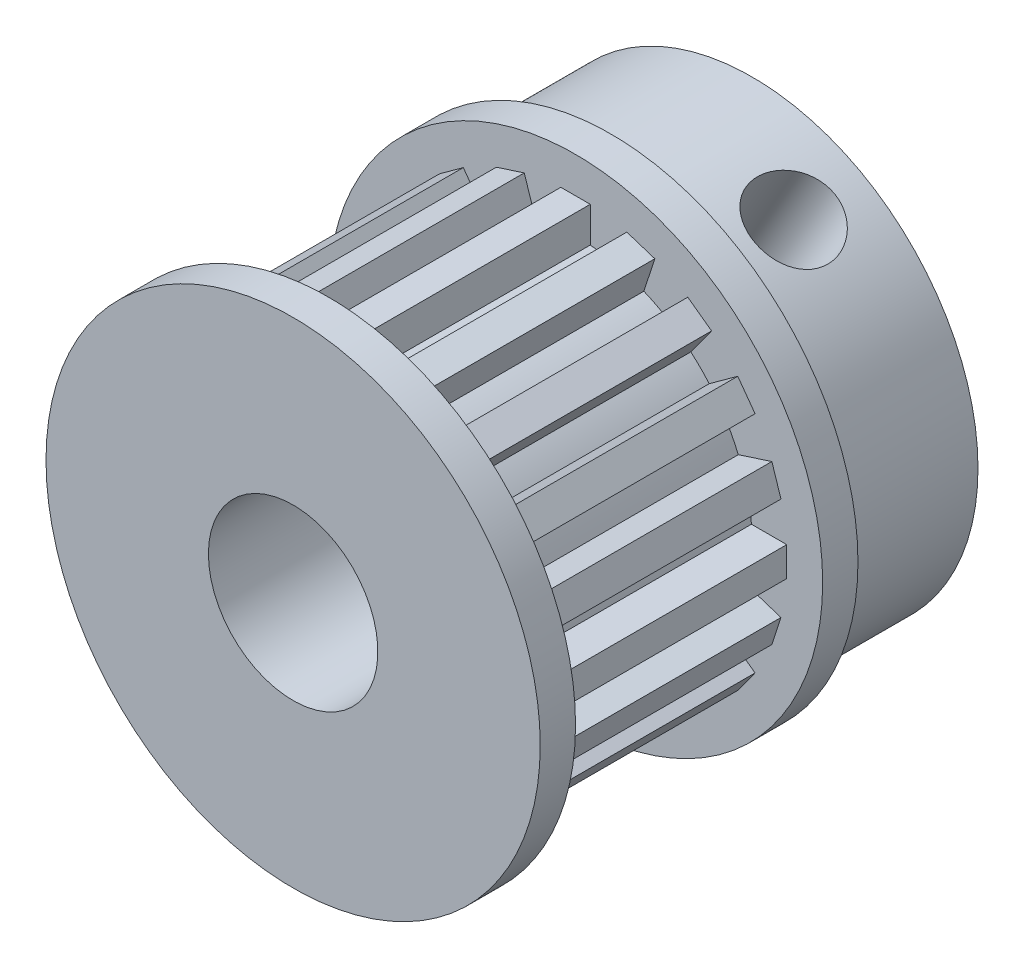
from build123d import *

# Parameters (mm, degrees)
ESQUISSE1_R                  = 2.4
BOSS_EXTRU_1_DEPTH           = 7
ESQUISSE2_R                  = 7
BOSS_EXTRU_2_DEPTH           = 1
ESQUISSE3_R                  = 2.4
ENL_V_MAT_EXTRU_1_DEPTH      = 1
BOSS_EXTRU_3_START           = 1
ESQUISSE4_R                  = 7
BOSS_EXTRU_3_DEPTH           = 1
ENL_V_START                  = -1
ESQUISSE5_R                  = 2.4
ENL_V_MAT_EXTRU_2_DEPTH      = 1
BOSS_EXTRU_4_START           = 4
ESQUISSE6_R                  = 6.4
ESQUISSE6_R_2                = 2.4
BOSS_EXTRU_4_DEPTH           = 4
ESQUISSE7_R                  = 1.15
ENL_V_MAT_EXTRU_3_DEPTH      = 8
R_P_TITION_CIRCULAIRE1_COUNT = 3


with BuildPart() as part:
    # Esquisse1 → Boss.-Extru.1 (new body)
    with BuildSketch(Plane.XY):
        with BuildLine():
            Line((0.41669139, 5.982606575), (-0.416666667, 5.982606575))
            Line((-0.416666667, 5.982606575), (-0.416666667, 4.982608643))
            ThreePointArc((-0.416666667, 4.982608643), (-0.782160073, 4.938443644), (-1.143413046, 4.867505173))
            Line((-1.143413046, 4.867505173), (-1.452430041, 5.818561689))
            Line((-1.452430041, 5.818561689), (-2.245000651, 5.561039887))
            Line((-2.245000651, 5.561039887), (-1.935984295, 4.609985337))
            ThreePointArc((-1.935984295, 4.609985337), (-2.269941446, 4.455038253), (-2.591592247, 4.27593845))
            Line((-2.591592247, 4.27593845), (-3.179377499, 5.084955444))
            Line((-3.179377499, 5.084955444), (-3.85357833, 4.595119868))
            Line((-3.85357833, 4.595119868), (-3.265794293, 3.786104547))
            ThreePointArc((-3.265794293, 3.786104547), (-3.535525134, 3.535542677), (-3.786088342, 3.265813079))
            Line((-3.786088342, 3.265813079), (-4.595105336, 3.853598331))
            Line((-4.595105336, 3.853598331), (-5.084940912, 3.179397501))
            Line((-5.084940912, 3.179397501), (-4.27592559, 2.591613464))
            ThreePointArc((-4.27592559, 2.591613464), (-4.455026989, 2.269963551), (-4.609975731, 1.93600717))
            Line((-4.609975731, 1.93600717), (-5.561032247, 2.245024164))
            Line((-5.561032247, 2.245024164), (-5.818554049, 1.452453554))
            Line((-5.818554049, 1.452453554), (-4.867499499, 1.143437199))
            ThreePointArc((-4.867499499, 1.143437199), (-4.938439762, 0.782184577), (-4.982606575, 0.41669139))
            Line((-4.982606575, 0.41669139), (-5.982606575, 0.41669139))
            Line((-5.982606575, 0.41669139), (-5.982606575, -0.416666667))
            Line((-5.982606575, -0.416666667), (-4.982608643, -0.416666667))
            ThreePointArc((-4.982608643, -0.416666667), (-4.938443644, -0.782160073), (-4.867505173, -1.143413046))
            Line((-4.867505173, -1.143413046), (-5.818561689, -1.452430041))
            Line((-5.818561689, -1.452430041), (-5.561039887, -2.245000651))
            Line((-5.561039887, -2.245000651), (-4.609985337, -1.935984295))
            ThreePointArc((-4.609985337, -1.935984295), (-4.455038253, -2.269941446), (-4.27593845, -2.591592247))
            Line((-4.27593845, -2.591592247), (-5.084955444, -3.179377499))
            Line((-5.084955444, -3.179377499), (-4.595119868, -3.85357833))
            Line((-4.595119868, -3.85357833), (-3.786104547, -3.265794293))
            ThreePointArc((-3.786104547, -3.265794293), (-3.535542677, -3.535525134), (-3.265813079, -3.786088342))
            Line((-3.265813079, -3.786088342), (-3.853598331, -4.595105336))
            Line((-3.853598331, -4.595105336), (-3.179397501, -5.084940912))
            Line((-3.179397501, -5.084940912), (-2.591613464, -4.27592559))
            ThreePointArc((-2.591613464, -4.27592559), (-2.269963551, -4.455026989), (-1.93600717, -4.609975731))
            Line((-1.93600717, -4.609975731), (-2.245024164, -5.561032247))
            Line((-2.245024164, -5.561032247), (-1.452453554, -5.818554049))
            Line((-1.452453554, -5.818554049), (-1.143437199, -4.867499499))
            ThreePointArc((-1.143437199, -4.867499499), (-0.782184577, -4.938439762), (-0.41669139, -4.982606575))
            Line((-0.41669139, -4.982606575), (-0.41669139, -5.982606575))
            Line((-0.41669139, -5.982606575), (0.416666667, -5.982606575))
            Line((0.416666667, -5.982606575), (0.416666667, -4.982608643))
            ThreePointArc((0.416666667, -4.982608643), (0.782160073, -4.938443644), (1.143413046, -4.867505173))
            Line((1.143413046, -4.867505173), (1.452430041, -5.818561689))
            Line((1.452430041, -5.818561689), (2.245000651, -5.561039887))
            Line((2.245000651, -5.561039887), (1.935984295, -4.609985337))
            ThreePointArc((1.935984295, -4.609985337), (2.269941446, -4.455038253), (2.591592247, -4.27593845))
            Line((2.591592247, -4.27593845), (3.179377499, -5.084955444))
            Line((3.179377499, -5.084955444), (3.85357833, -4.595119868))
            Line((3.85357833, -4.595119868), (3.265794293, -3.786104547))
            ThreePointArc((3.265794293, -3.786104547), (3.535525134, -3.535542677), (3.786088342, -3.265813079))
            Line((3.786088342, -3.265813079), (4.595105336, -3.853598331))
            Line((4.595105336, -3.853598331), (5.084940912, -3.179397501))
            Line((5.084940912, -3.179397501), (4.27592559, -2.591613464))
            ThreePointArc((4.27592559, -2.591613464), (4.455026989, -2.269963551), (4.609975731, -1.93600717))
            Line((4.609975731, -1.93600717), (5.561032247, -2.245024164))
            Line((5.561032247, -2.245024164), (5.818554049, -1.452453554))
            Line((5.818554049, -1.452453554), (4.867499499, -1.143437199))
            ThreePointArc((4.867499499, -1.143437199), (4.938439762, -0.782184577), (4.982606575, -0.41669139))
            Line((4.982606575, -0.41669139), (5.982606575, -0.41669139))
            Line((5.982606575, -0.41669139), (5.982606575, 0.416666667))
            Line((5.982606575, 0.416666667), (4.982608643, 0.416666667))
            ThreePointArc((4.982608643, 0.416666667), (4.938443644, 0.782160073), (4.867505173, 1.143413046))
            Line((4.867505173, 1.143413046), (5.818561689, 1.452430041))
            Line((5.818561689, 1.452430041), (5.561039887, 2.245000651))
            Line((5.561039887, 2.245000651), (4.609985337, 1.935984295))
            ThreePointArc((4.609985337, 1.935984295), (4.455038253, 2.269941446), (4.27593845, 2.591592247))
            Line((4.27593845, 2.591592247), (5.084955444, 3.179377499))
            Line((5.084955444, 3.179377499), (4.595119868, 3.85357833))
            Line((4.595119868, 3.85357833), (3.786104547, 3.265794293))
            ThreePointArc((3.786104547, 3.265794293), (3.535542677, 3.535525134), (3.265813079, 3.786088342))
            Line((3.265813079, 3.786088342), (3.853598331, 4.595105336))
            Line((3.853598331, 4.595105336), (3.179397501, 5.084940912))
            Line((3.179397501, 5.084940912), (2.591613464, 4.27592559))
            ThreePointArc((2.591613464, 4.27592559), (2.269963551, 4.455026989), (1.93600717, 4.609975731))
            Line((1.93600717, 4.609975731), (2.245024164, 5.561032247))
            Line((2.245024164, 5.561032247), (1.452453554, 5.818554049))
            Line((1.452453554, 5.818554049), (1.143437199, 4.867499499))
            ThreePointArc((1.143437199, 4.867499499), (0.782184577, 4.938439762), (0.41669139, 4.982606575))
            Line((0.41669139, 4.982606575), (0.41669139, 5.982606575))
        make_face()
        Circle(ESQUISSE1_R, mode=Mode.SUBTRACT)
    extrude(amount=BOSS_EXTRU_1_DEPTH)

    # Esquisse2 → Boss.-Extru.2 (add)
    with BuildSketch(Plane.XY.offset(7)):
        Circle(ESQUISSE2_R)
    extrude(amount=BOSS_EXTRU_2_DEPTH)

    # Esquisse3 → Enlèv. mat.-Extru.1 (cut)
    with BuildSketch(Plane(origin=(0, 0, 7), x_dir=(-1, 0, 0), z_dir=(0, 0, -1))):
        Circle(ESQUISSE3_R)
    extrude(amount=-ENL_V_MAT_EXTRU_1_DEPTH, mode=Mode.SUBTRACT)

    # Esquisse4 → Boss.-Extru.3 (add)
    with BuildSketch(Plane(origin=(0, 0, 0), x_dir=(-1, 0, 0), z_dir=(0, 0, -1)).offset(BOSS_EXTRU_3_START)):
        with Locations(Location((0, 0, 0), (0, 0, 180))):
            Circle(ESQUISSE4_R)
    extrude(amount=-BOSS_EXTRU_3_DEPTH)

    # Esquisse5 → Enlèv. mat.-Extru.2 (cut)
    with BuildSketch(Plane.XY.offset(ENL_V_START)):
        with Locations(Location((0, 0, 0), (0, 0, 180))):
            Circle(ESQUISSE5_R)
    extrude(amount=ENL_V_MAT_EXTRU_2_DEPTH, mode=Mode.SUBTRACT)

    # Esquisse6 → Boss.-Extru.4 (add)
    with BuildSketch(Plane(origin=(0, 0, -1), x_dir=(-1, 0, 0), z_dir=(0, 0, -1)).offset(BOSS_EXTRU_4_START)):
        Circle(ESQUISSE6_R)
        Circle(ESQUISSE6_R_2, mode=Mode.SUBTRACT)
    extrude(amount=-BOSS_EXTRU_4_DEPTH)

    # Esquisse7 → Enlèv. mat.-Extru.3 (cut)
    with BuildSketch(Plane(origin=(0, 0, 0), x_dir=(0, 0, -1), z_dir=(1, 0, 0))):
        with Locations((3, 0)):
            Circle(ESQUISSE7_R)
    enl_v_mat_extru_3 = extrude(amount=-ENL_V_MAT_EXTRU_3_DEPTH, mode=Mode.SUBTRACT)

    # Répétition circulaire1: Enlèv. mat.-Extru.3 ×3 about axis
    r_p_tition_circulaire1_axis = Axis((0, 0, 0), (0, 0, -1))
    for i in range(1, R_P_TITION_CIRCULAIRE1_COUNT):
        add(enl_v_mat_extru_3.rotate(r_p_tition_circulaire1_axis, i * 360 / R_P_TITION_CIRCULAIRE1_COUNT), mode=Mode.SUBTRACT)


solid = part.part
